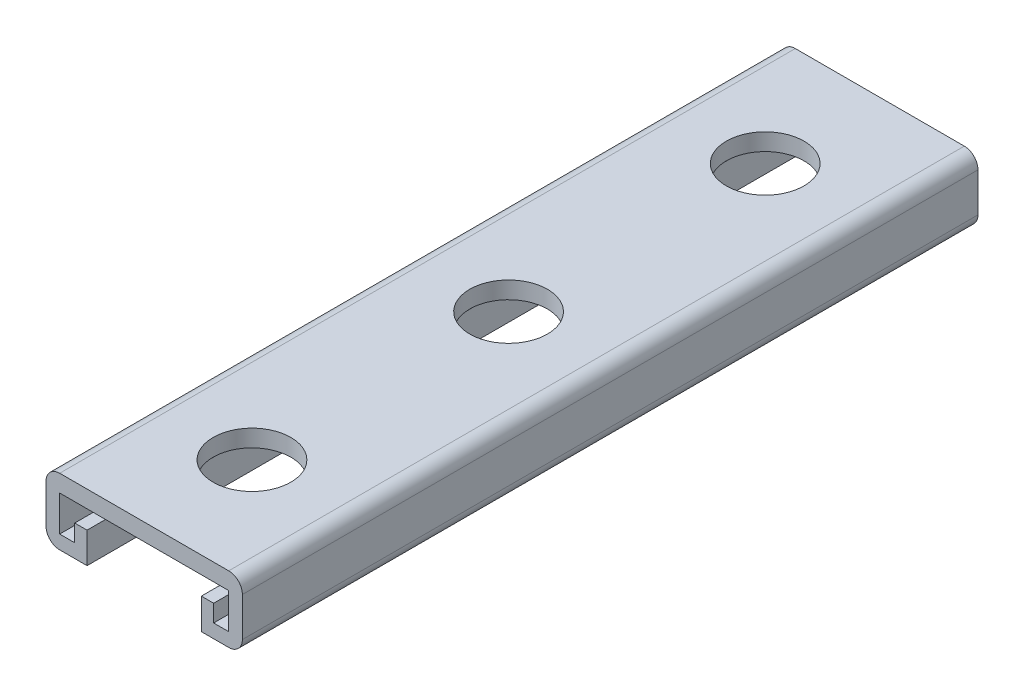
from build123d import *

# Parameters (mm, degrees)
BOSS_EXTRUDE2_DEPTH = 213
SKETCH2_W           = 57.4
SKETCH2_H           = 19.4
BOSS_EXTRUDE3_DEPTH = 2
FILLET2_R           = 4
SKETCH3_R           = 11.35
CUT_EXTRUDE1_DEPTH  = 59


with BuildPart() as part:
    # Sketch1 → Boss-Extrude2 (new body)
    with BuildSketch(Plane.XY):
        Polygon((-24.7, 0.2), (0, 0.2), (0, 5.2), (-28.7, 5.2), (-28.7, -14.2), (-16.7, -14.2), (-16.7, -10), (-16.7, -5.2), (-20.3, -5.2), (-20.3, -10.2), (-24.7, -10.2), align=None)
        Polygon((0, 5.2), (0, 0.2), (24.7, 0.2), (24.7, -10.2), (20.3, -10.2), (20.3, -5.2), (16.7, -5.2), (16.7, -10), (16.7, -14.2), (28.7, -14.2), (28.7, 5.2), align=None)
    extrude(amount=BOSS_EXTRUDE2_DEPTH)

    # Sketch2 → Boss-Extrude3 (add)
    with BuildSketch(Plane(origin=(0, 0, 0), x_dir=(-1, 0, 0), z_dir=(0, 0, -1))):
        with Locations((0, -4.5)):
            Rectangle(SKETCH2_W, SKETCH2_H)
    extrude(amount=BOSS_EXTRUDE3_DEPTH)

    # Fillet2
    fillet2_edges = [part.edges().sort_by_distance(p)[0] for p in [
        (-28.7, -14.2, 105.5),
        (-28.7, 5.2, 105.5),
        (28.7, 5.2, 105.5),
        (28.7, -14.2, 105.5),
    ]]
    fillet(fillet2_edges, radius=FILLET2_R)

    # Sketch3 → Cut-Extrude1 (cut)
    with BuildSketch(Plane(origin=(0, 5.2, 0), x_dir=(1, 0, 0), z_dir=(0, 1, 0))):
        with Locations(Location((0, -31.5, 0), (0, 0, 180))):
            Circle(SKETCH3_R)
        with Locations(Location((0, -106.5, 0), (0, 0, 180))):
            Circle(SKETCH3_R)
        with Locations(Location((0, -181.5, 0), (0, 0, 180))):
            Circle(SKETCH3_R)
    extrude(amount=-CUT_EXTRUDE1_DEPTH, mode=Mode.SUBTRACT)


solid = part.part
